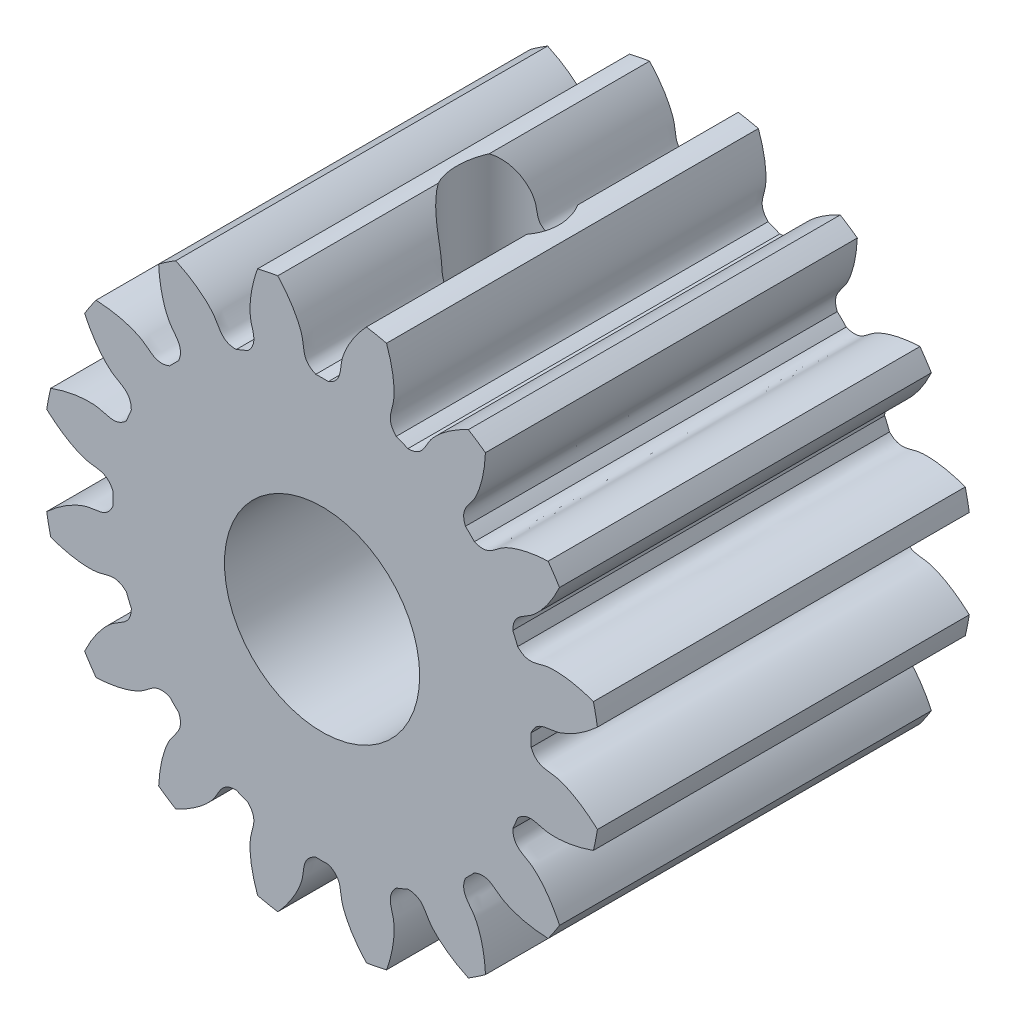
from build123d import *

# Parameters (mm, degrees)
SKETCH_1_R               = 4.5
EXTRUDE_1_DEPTH          = 6
CUT_EXTRUDE_1_DEPTH      = 9.746427842
PATTERN_CIRCULAR_1_COUNT = 16
SKETCH_4_R               = 1.575
CUT_EXTRUDE_2_DEPTH      = 10
CUT_EXTRUDE_3_REACH      = 10.688
SKETCH_5_R               = 0.825


with BuildPart() as part:
    # 草图1 → 凸台-拉伸1 (new body)
    with BuildSketch(Plane.XY):
        Circle(SKETCH_1_R)
    extrude(amount=EXTRUDE_1_DEPTH)

    # 草图2 → 切除-拉伸1 (cut, through all)
    with BuildSketch(Plane.XY):
        with BuildLine():
            ThreePointArc((0.101680395, 3.373467963), (0, 3.375), (-0.101680395, 3.373467963))
            add(Edge.make_bspline(
                [(-0.101680395, 3.373467963), (-0.320919735, 3.465061005), (-0.284660598, 3.635349809), (-0.322390644, 3.793404963), (-0.325601394, 3.80577545), (-0.329466049, 3.819526781), (-0.334039479, 3.834637453), (-0.339377888, 3.851083952), (-0.345536205, 3.868841182), (-0.352568839, 3.887882349), (-0.360529384, 3.908179024), (-0.369470654, 3.92970115), (-0.379444617, 3.952417062), (-0.390502356, 3.976293514), (-0.402694025, 4.001295699), (-0.416068812, 4.02738727), (-0.430674889, 4.054530373), (-0.446559381, 4.082685666), (-0.463768319, 4.111812348), (-0.482346604, 4.141868189), (-0.502337967, 4.172809557), (-0.523784931, 4.20459145), (-0.546728776, 4.237167525), (-0.571209498, 4.270490132), (-0.597265778, 4.304510345), (-0.624934946, 4.339177997), (-0.654252942, 4.374441713), (-0.685254293, 4.41024895), (-0.717972069, 4.446546028), (-0.752437861, 4.483278171), (-0.788681746, 4.520389541), (-0.826732258, 4.557823283), (-0.866616358, 4.595521557), (-0.90835941, 4.633425586), (-0.951985152, 4.67147569), (-0.99751567, 4.709611333), (-1.044971373, 4.747771162), (-1.094370973, 4.785893051), (-1.145731456, 4.823914147), (-1.199068069, 4.861770908), (-1.254394289, 4.899399156), (-1.311721817, 4.936734114), (-1.371060539, 4.97371046), (-1.453732402, 5.022959339), (-1.517494148, 5.058370721), (-1.560889991, 5.081371225)],
                knots=[0, 0, 0, 0, 0.200958108, 0.205848205, 0.211390316, 0.217584439, 0.224430575, 0.231928724, 0.240078886, 0.248881062, 0.25833525, 0.268441451, 0.279199665, 0.290609892, 0.302672132, 0.315386384, 0.32875265, 0.342770929, 0.357441221, 0.372763526, 0.388737843, 0.405364174, 0.422642518, 0.440572874, 0.459155244, 0.478389626, 0.498276022, 0.51881443, 0.540004852, 0.561847286, 0.584341734, 0.607488194, 0.631286667, 0.655737153, 0.680839653, 0.706594165, 0.73300069, 0.760059228, 0.787769779, 0.816132343, 0.84514692, 0.87481351, 0.905132113, 0.936102729, 1, 1, 1, 1], degree=3))
            ThreePointArc((-1.560889991, 5.081371225), (0, 5.315704195), (1.560889991, 5.081371225))
            add(Edge.make_bspline(
                [(0.101680395, 3.373467963), (0.320919735, 3.465061005), (0.284660598, 3.635349809), (0.322390644, 3.793404963), (0.325601394, 3.80577545), (0.329466049, 3.819526781), (0.334039479, 3.834637453), (0.339377888, 3.851083952), (0.345536205, 3.868841182), (0.352568839, 3.887882349), (0.360529384, 3.908179024), (0.369470654, 3.92970115), (0.379444617, 3.952417062), (0.390502356, 3.976293514), (0.402694025, 4.001295699), (0.416068812, 4.02738727), (0.430674889, 4.054530373), (0.446559381, 4.082685666), (0.463768319, 4.111812348), (0.482346604, 4.141868189), (0.502337967, 4.172809557), (0.523784931, 4.20459145), (0.546728776, 4.237167525), (0.571209498, 4.270490132), (0.597265778, 4.304510345), (0.624934946, 4.339177997), (0.654252942, 4.374441713), (0.685254293, 4.41024895), (0.717972069, 4.446546028), (0.752437861, 4.483278171), (0.788681746, 4.520389541), (0.826732258, 4.557823283), (0.866616358, 4.595521557), (0.90835941, 4.633425586), (0.951985152, 4.67147569), (0.99751567, 4.709611333), (1.044971373, 4.747771162), (1.094370973, 4.785893051), (1.145731456, 4.823914147), (1.199068069, 4.861770908), (1.254394289, 4.899399156), (1.311721817, 4.936734114), (1.371060539, 4.97371046), (1.453732402, 5.022959339), (1.517494148, 5.058370721), (1.560889991, 5.081371225)],
                knots=[0, 0, 0, 0, 0.200958108, 0.205848205, 0.211390316, 0.217584439, 0.224430575, 0.231928724, 0.240078886, 0.248881062, 0.25833525, 0.268441451, 0.279199665, 0.290609892, 0.302672132, 0.315386384, 0.32875265, 0.342770929, 0.357441221, 0.372763526, 0.388737843, 0.405364174, 0.422642518, 0.440572874, 0.459155244, 0.478389626, 0.498276022, 0.51881443, 0.540004852, 0.561847286, 0.584341734, 0.607488194, 0.631286667, 0.655737153, 0.680839653, 0.706594165, 0.73300069, 0.760059228, 0.787769779, 0.816132343, 0.84514692, 0.87481351, 0.905132113, 0.936102729, 1, 1, 1, 1], degree=3))
        make_face()
    cut_extrude_1 = extrude(amount=CUT_EXTRUDE_1_DEPTH, mode=Mode.SUBTRACT)

    # 阵列(圆周)1: 切除-拉伸1 ×16 about axis
    pattern_circular_1_axis = Axis((0, 0, 6), (0, 0, -1))
    for i in range(1, PATTERN_CIRCULAR_1_COUNT):
        add(cut_extrude_1.rotate(pattern_circular_1_axis, i * 360 / PATTERN_CIRCULAR_1_COUNT), mode=Mode.SUBTRACT)

    # 草图4 → 切除-拉伸2 (cut)
    with BuildSketch(Plane.XY.offset(6)):
        Circle(SKETCH_4_R)
    extrude(amount=-CUT_EXTRUDE_2_DEPTH, mode=Mode.SUBTRACT)

    # 草图5 → 切除-拉伸3 (cut, up to next)
    with BuildSketch(Plane(origin=(0, 0, 0), x_dir=(1, 0, 0), z_dir=(0, 1, 0)), mode=Mode.PRIVATE) as cut_extrude_3_sk1:
        with Locations((0, -3)):
            Circle(SKETCH_5_R)
    cut_extrude_3_tool1 = extrude(cut_extrude_3_sk1.sketch, amount=CUT_EXTRUDE_3_REACH, mode=Mode.PRIVATE) & part.part
    add(cut_extrude_3_tool1.solids().sort_by_distance((0, 0, 3))[0], mode=Mode.SUBTRACT)


solid = part.part
